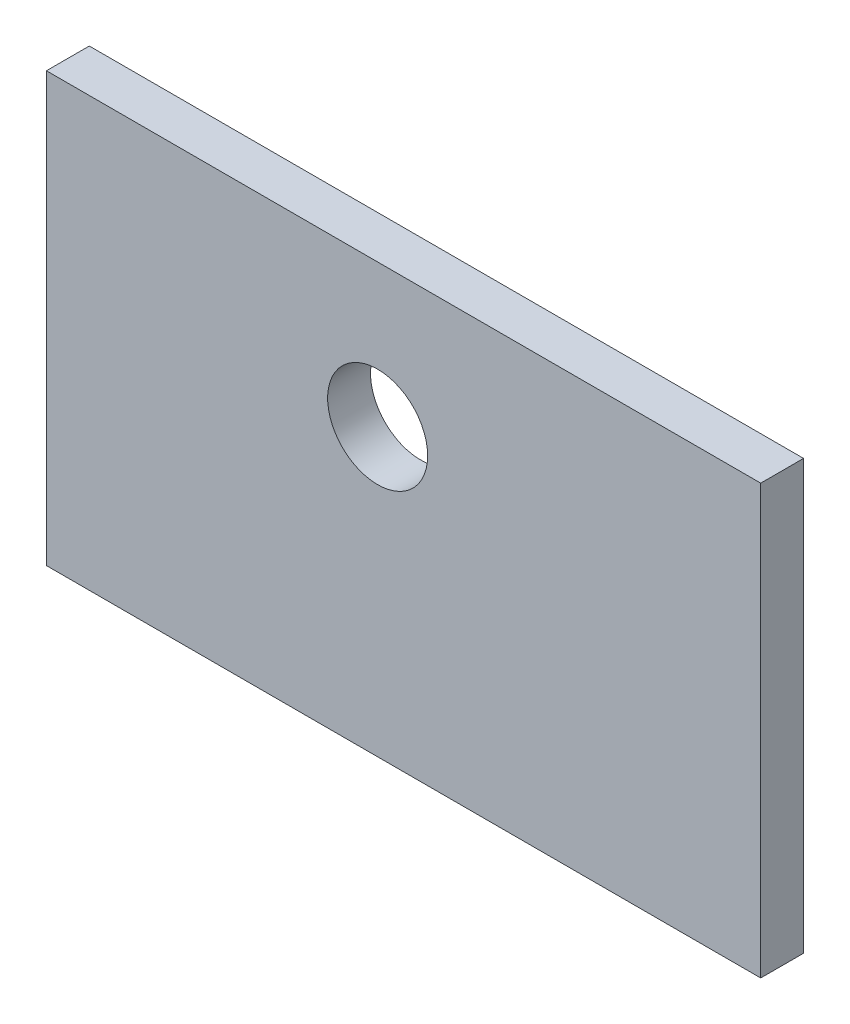
from build123d import *

# Parameters (mm, degrees)
ESQUISSE1_W        = 50
ESQUISSE1_H        = 30
ESQUISSE1_R        = 3.5
BOSS_EXTRU_1_DEPTH = 3


with BuildPart() as part:
    # Esquisse1 → Boss.-Extru.1 (new body)
    with BuildSketch(Plane.XY):
        with Locations((25, 15)):
            Rectangle(ESQUISSE1_W, ESQUISSE1_H)
        with Locations((23.185014848, 20)):
            Circle(ESQUISSE1_R, mode=Mode.SUBTRACT)
    extrude(amount=BOSS_EXTRU_1_DEPTH)


solid = part.part
